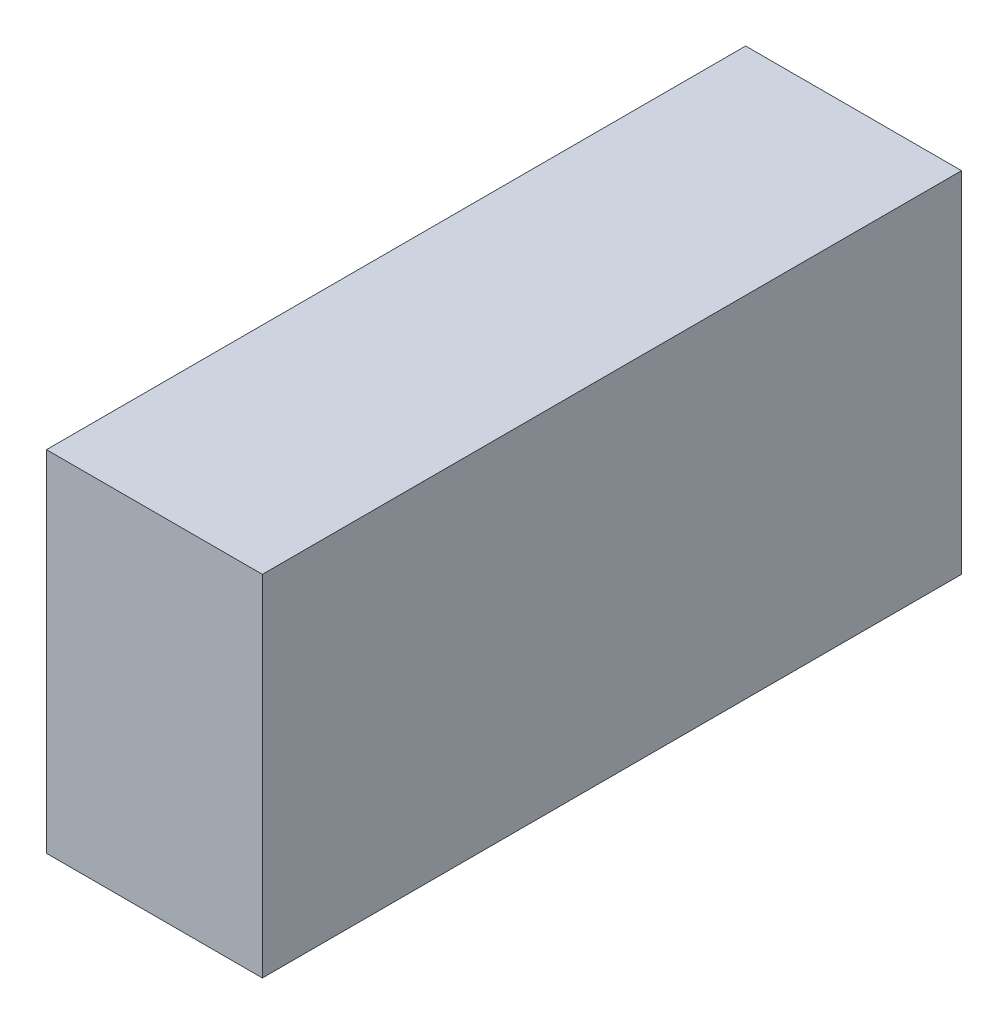
from build123d import *

# Parameters (mm, degrees)
SZKIC1_W                    = 42
SZKIC1_H                    = 136
DODANIE_WYCI_GNI_CIE1_DEPTH = 68


with BuildPart() as part:
    # Szkic1 → Dodanie-wyciągnięcie1 (new body)
    with BuildSketch(Plane(origin=(0, 0, 0), x_dir=(1, 0, 0), z_dir=(0, 1, 0))):
        with Locations((21, 68)):
            Rectangle(SZKIC1_W, SZKIC1_H)
    extrude(amount=DODANIE_WYCI_GNI_CIE1_DEPTH)


solid = part.part
